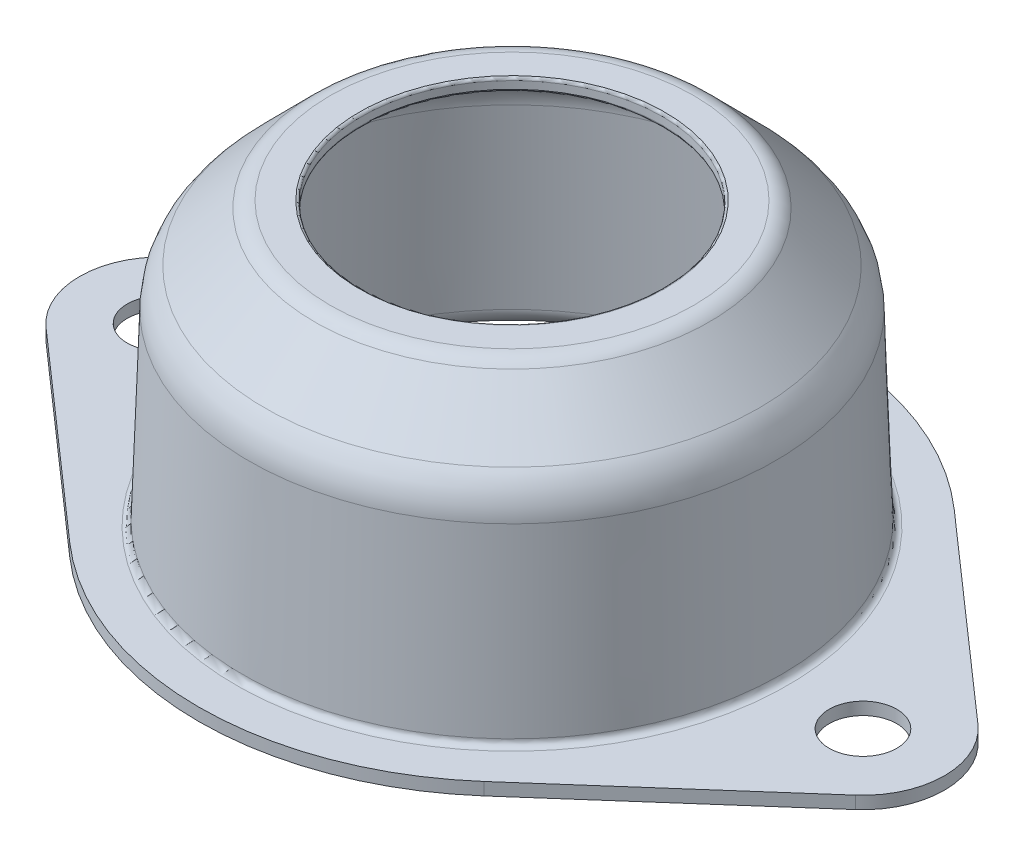
from build123d import *

# Parameters (mm, degrees)
SKETCH2_R            = 2.7
BASE_DEPTH           = 1
M5_CLEARANCE_HOLE2_D = 5.4
IBC_TOP_F_R          = 0.2


with BuildPart() as part:
    # Sketch2 → BASE (new body)
    with BuildSketch(Plane(origin=(0, 0, 0), x_dir=(1, 0, 0), z_dir=(0, 1, 0))):
        with BuildLine():
            Line((-16.517857143, 18.765937104), (-32.294642857, 4.879143647))
            ThreePointArc((-32.294642857, 4.879143647), (-34.5, 0), (-32.294642857, -4.879143647))
            Line((-32.294642857, -4.879143647), (-16.517857143, -18.765937104))
            ThreePointArc((-16.517857143, -18.765937104), (0, -25), (16.517857143, -18.765937104))
            Line((16.517857143, -18.765937104), (32.294642857, -4.879143647))
            ThreePointArc((32.294642857, -4.879143647), (34.5, 0), (32.294642857, 4.879143647))
            Line((32.294642857, 4.879143647), (16.517857143, 18.765937104))
            ThreePointArc((16.517857143, 18.765937104), (0, 25), (-16.517857143, 18.765937104))
        make_face()
        with Locations(Location((-28, 0, 0), (0, 0, 270))):
            Circle(SKETCH2_R, mode=Mode.SUBTRACT)
        with Locations(Location((28, 0, 0), (0, 0, 270))):
            Circle(SKETCH2_R, mode=Mode.SUBTRACT)
    extrude(amount=BASE_DEPTH)

    # Sketch1 → TOP BODY (revolve)
    with BuildSketch(Plane.XY, mode=Mode.PRIVATE) as top_body_sk:
        with BuildLine():
            Line((21, 16), (21.5, 1.5))
            ThreePointArc((21.5, 1.5), (21.646446609, 1.146446609), (22, 1))
            Line((22, 1), (0, 1))
            Line((0, 1), (0, 23.5))
            Line((0, 23.5), (14.5, 23.5))
            ThreePointArc((14.5, 23.5), (15.176977799, 23.364736201), (15.75, 22.979715691))
            Line((15.75, 22.979715691), (19.702464839, 19))
            ThreePointArc((19.702464839, 19), (20.634851716, 17.62266867), (21, 16))
        make_face()
    revolve(top_body_sk.sketch.rotate(Axis((0, 23.5, 0), (0, -1, 0)), 180), axis=Axis((0, 23.5, 0), (0, -1, 0)))

    # M5 Clearance Hole2 (through all)
    with Locations(Plane(origin=(0, 1, 0), x_dir=(1, 0, 0), z_dir=(0, 1, 0))):
        with Locations((-28, 0), (28, 0)):
            Hole(M5_CLEARANCE_HOLE2_D / 2)

    # Sketch8 → INNER BODY CUT (revolve, cut)
    with BuildSketch(Plane.XY, mode=Mode.PRIVATE) as inner_body_cut_sk:
        with BuildLine():
            Line((-15.040468154, 22.27504232), (-18.992932994, 18.295326629))
            ThreePointArc((-18.992932994, 18.295326629), (-19.717021194, 17.225696212), (-20.000594001, 15.965537724))
            Line((-20.000594001, 15.965537724), (-20.500159189, 1.478147253))
            ThreePointArc((-20.500159189, 1.478147253), (-20.947094287, 0.431641652), (-22, 0))
            Line((-22, 0), (0, 0))
            Line((0, 0), (0, 23.5))
            Line((0, 23.5), (-12, 23.5))
            Line((-12, 23.5), (-12, 22.5))
            Line((-12, 22.5), (-14.5, 22.5))
            ThreePointArc((-14.5, 22.5), (-14.792707953, 22.441515379), (-15.040468154, 22.27504232))
        make_face()
    revolve(inner_body_cut_sk.sketch.rotate(Axis((0, 0, 0), (0, 1, 0)), 270), axis=Axis((0, 0, 0), (0, 1, 0)), mode=Mode.SUBTRACT)

    # IBC TOP F
    ibc_top_f_edges = [part.edges().sort_by_distance(p)[0] for p in [
        (0, 23.5, 12),
        (0, 22.5, 12),
    ]]
    fillet(ibc_top_f_edges, radius=IBC_TOP_F_R)


solid = part.part
